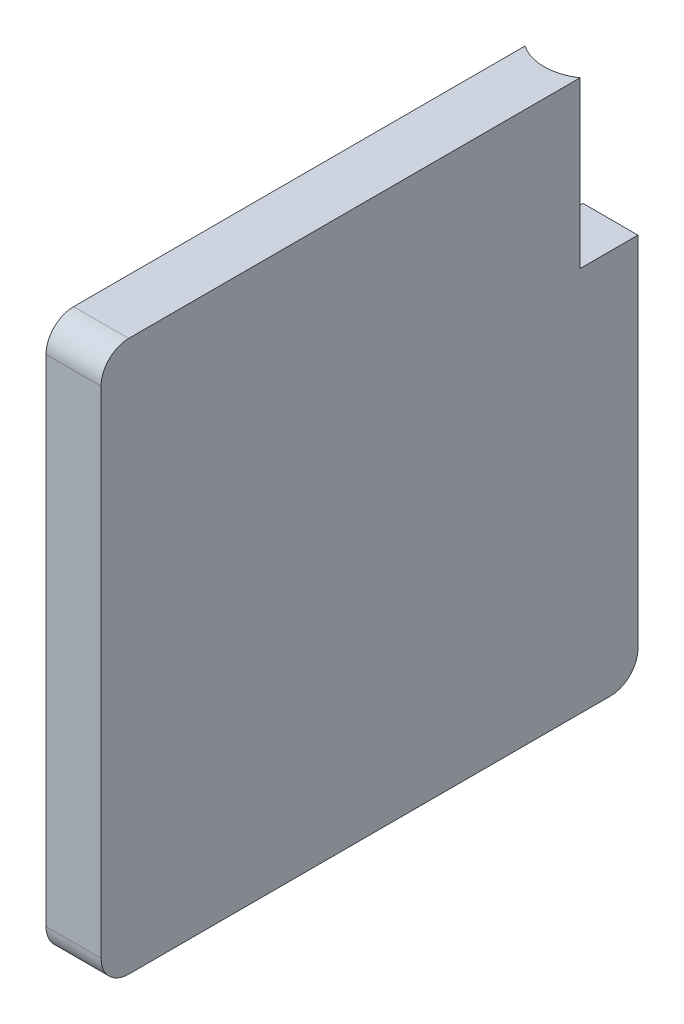
from build123d import *

# Parameters (mm, degrees)
SKETCH1_W           = 4
SKETCH1_H           = 40
BOSS_EXTRUDE1_DEPTH = 39
SKETCH2_W           = 4
SKETCH2_H           = 12
CUT_EXTRUDE1_DEPTH  = 39
SKETCH5_R           = 3.567899071
CUT_EXTRUDE3_DEPTH  = 12
FILLET6_R           = 2
FILLET7_R           = 2


with BuildPart() as part:
    # Sketch1 → Boss-Extrude1 (new body)
    with BuildSketch(Plane.XY):
        with Locations((-2, 5.490763705)):
            Rectangle(SKETCH1_W, SKETCH1_H)
    extrude(amount=BOSS_EXTRUDE1_DEPTH)

    # Sketch2 → Cut-Extrude1 (cut)
    with BuildSketch(Plane(origin=(0, 0, 0), x_dir=(0, 0, -1), z_dir=(1, 0, 0))):
        with Locations((-2, 19.490763705)):
            Rectangle(SKETCH2_W, SKETCH2_H)
    extrude(amount=-CUT_EXTRUDE1_DEPTH, mode=Mode.SUBTRACT)

    # Sketch5 → Cut-Extrude3 (cut)
    with BuildSketch(Plane(origin=(0, 25.490763705, 0), x_dir=(1, 0, 0), z_dir=(0, 1, 0))):
        with Locations((-2, -1.249948334)):
            Circle(SKETCH5_R)
    extrude(amount=-CUT_EXTRUDE3_DEPTH, mode=Mode.SUBTRACT)

    # Fillet6
    fillet6_edges = [part.edges().sort_by_distance(p)[0] for p in [
        (-2, 25.490763705, 39),
    ]]
    fillet(fillet6_edges, radius=FILLET6_R)

    # Fillet7
    fillet7_edges = [part.edges().sort_by_distance(p)[0] for p in [
        (-2, -14.509236295, 0),
        (-2, -14.509236295, 39),
    ]]
    fillet(fillet7_edges, radius=FILLET7_R)


solid = part.part
